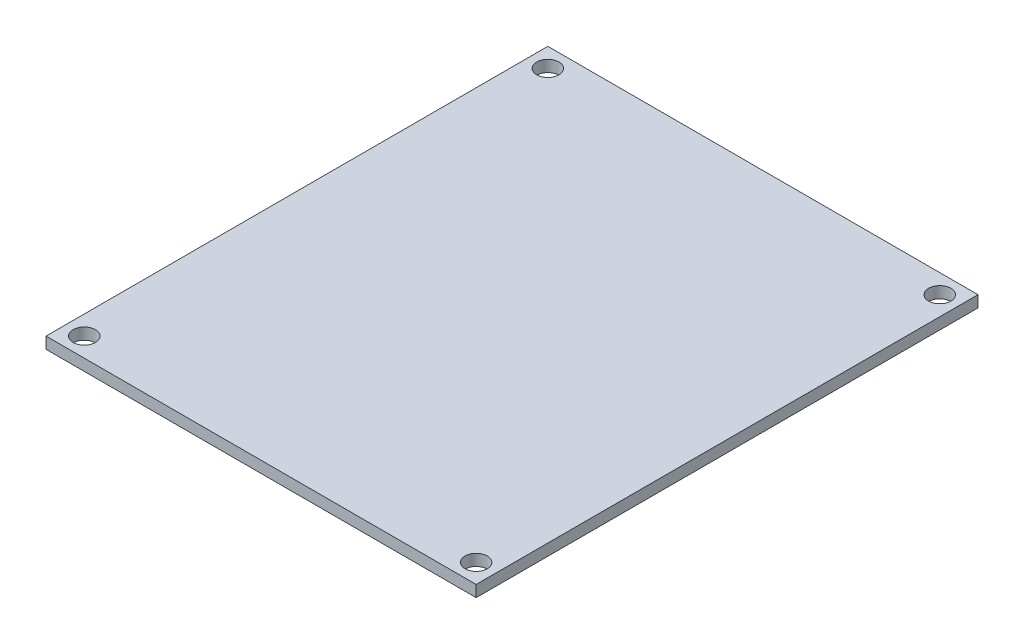
from build123d import *

# Parameters (mm, degrees)
SKETCH2_W           = 60
SKETCH2_H           = 70
BOSS_EXTRUDE1_DEPTH = 1.6
SKETCH3_R           = 1.55
CUT_EXTRUDE1_DEPTH  = 47.125481027


with BuildPart() as part:
    # Sketch2 → Boss-Extrude1 (new body)
    with BuildSketch(Plane(origin=(0, 0, 0), x_dir=(1, 0, 0), z_dir=(0, 1, 0))):
        Rectangle(SKETCH2_W, SKETCH2_H)
    extrude(amount=BOSS_EXTRUDE1_DEPTH)

    # Sketch3 → Cut-Extrude1 (cut, through all)
    with BuildSketch(Plane(origin=(0, 1.6, 0), x_dir=(1, 0, 0), z_dir=(0, 1, 0))):
        with Locations(Location((-27.333, 32.333, 0), (0, 0, 270))):
            Circle(SKETCH3_R)
        with Locations(Location((27.333, 32.333, 0), (0, 0, 90))):
            Circle(SKETCH3_R)
        with Locations(Location((27.333, -32.333, 0), (0, 0, 270))):
            Circle(SKETCH3_R)
        with Locations(Location((-27.333, -32.333, 0), (0, 0, 90))):
            Circle(SKETCH3_R)
    extrude(amount=-CUT_EXTRUDE1_DEPTH, mode=Mode.SUBTRACT)


solid = part.part
